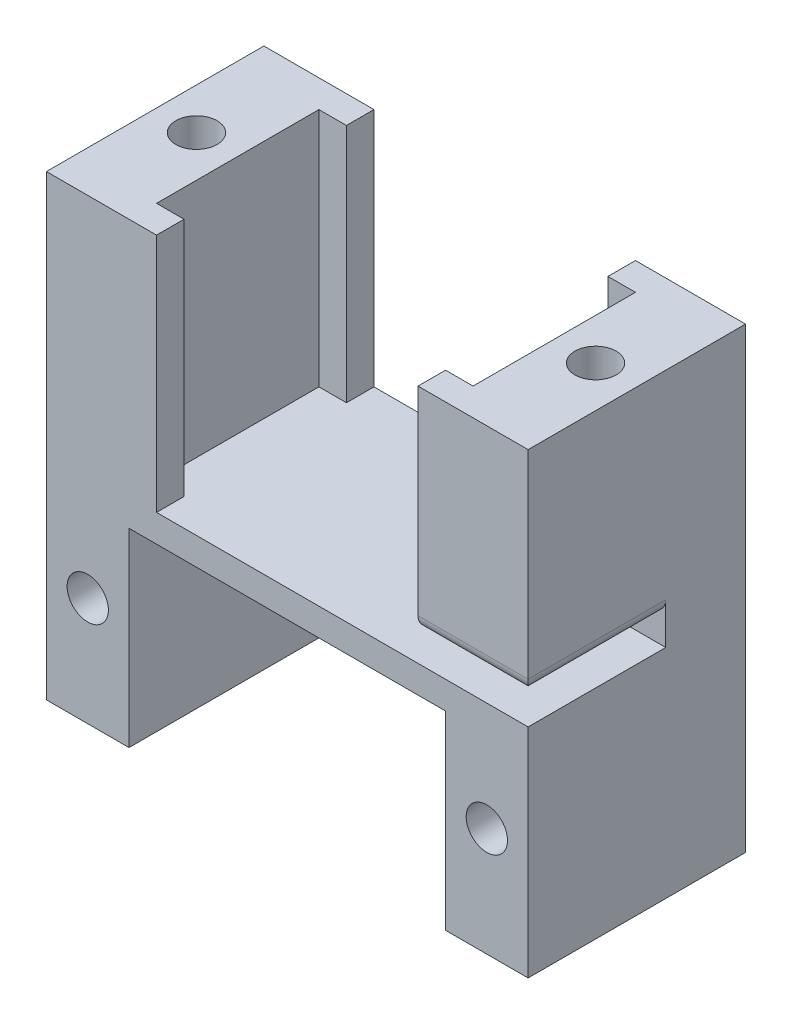
from build123d import *

# Parameters (mm, degrees)
SKETCH1_R           = 1.5
BOSS_EXTRUDE1_DEPTH = 19.45
BOSS_EXTRUDE2_START = -5
SKETCH2_R           = 1.5
BOSS_EXTRUDE2_DEPTH = 5
SKETCH5_W           = 35
SKETCH5_H           = 15.8
BOSS_EXTRUDE3_DEPTH = 2
SKETCH6_R           = 1.5
BOSS_EXTRUDE4_DEPTH = 15.8
SKETCH7_W           = 19
SKETCH7_H           = 2
BOSS_EXTRUDE5_DEPTH = 15.8
SKETCH8_W           = 8
SKETCH8_H           = 2
CUT_EXTRUDE1_DEPTH  = 10
FILLET1_R           = 1
SKETCH9_W           = 23
SKETCH9_H           = 2
CUT_EXTRUDE2_DEPTH  = 44
FILLET2_R           = 1


with BuildPart() as part:
    # Sketch1 → Boss-Extrude1 (new body)
    with BuildSketch(Plane(origin=(0, 0, 0), x_dir=(1, 0, 0), z_dir=(0, 1, 0))):
        Polygon((-5, 7.9), (3, 7.9), (3, 5.9), (3, -5.9), (3, -7.9), (-5, -7.9), (-5, -5.9), (-3, -5.9), (-3, 5.9), (-5, 5.9), align=None)
        with Locations(Location((0, 0, 0), (0, 0, 270))):
            Circle(SKETCH1_R, mode=Mode.SUBTRACT)
    extrude(amount=-BOSS_EXTRUDE1_DEPTH)

    # Sketch2 → Boss-Extrude2 (add)
    with BuildSketch(Plane.XZ.offset(19.45).offset(BOSS_EXTRUDE2_START)):
        with Locations(Location((0, 0, 0), (0, 0, 90))):
            Circle(SKETCH2_R)
    extrude(amount=BOSS_EXTRUDE2_DEPTH)


with BuildPart() as body_2:
    # Mirror2: mirrored copy
    add(part.part.mirror(Plane.ZY.offset(14.5)))


with BuildPart() as part_1:
    add(part.part)

    add(body_2.part)  # Boss-Extrude3 merges body 2
    # Sketch5 → Boss-Extrude3 (add)
    with BuildSketch(Plane.XZ.offset(19.45)):
        with Locations((-14.5, 0)):
            Rectangle(SKETCH5_W, SKETCH5_H)
    extrude(amount=-BOSS_EXTRUDE3_DEPTH)

    # Sketch6 → Boss-Extrude4 (add)
    # profile 1 of 2: a face of its own
    with BuildSketch(Plane.XY.offset(7.9)):
        Polygon((-26, -31.25), (-26, -19.45), (-32, -19.45), (-32, -31.25), (-32, -33.25), (-24, -33.25), (-24, -31.25), align=None)
        with Locations((-29, -25.35)):
            Circle(SKETCH6_R, mode=Mode.SUBTRACT)
    # profile 2 of 2: a face of its own
    with BuildSketch(Plane.XY.offset(7.9)):
        Polygon((-3, -19.45), (-3, -31.25), (-5, -31.25), (-5, -33.25), (3, -33.25), (3, -31.25), (3, -19.45), align=None)
        with Locations((0, -25.35)):
            Circle(SKETCH6_R, mode=Mode.SUBTRACT)
    extrude(amount=-BOSS_EXTRUDE4_DEPTH)

    # Sketch7 → Boss-Extrude5 (add)
    with BuildSketch(Plane.XY.offset(7.9)):
        with Locations((-14.5, -32.25)):
            Rectangle(SKETCH7_W, SKETCH7_H)
    extrude(amount=-BOSS_EXTRUDE5_DEPTH)

    # Sketch8 → Cut-Extrude1 (cut)
    with BuildSketch(Plane.XY.offset(7.9)):
        with Locations((-1, -16.45)):
            Rectangle(SKETCH8_W, SKETCH8_H)
    extrude(amount=-CUT_EXTRUDE1_DEPTH, mode=Mode.SUBTRACT)

    # Fillet1
    fillet1_edges = [part_1.edges().sort_by_distance(p)[0] for p in [
        (3, -15.45, 2.9),
        (-1, -15.45, 7.9),
    ]]
    fillet(fillet1_edges, radius=FILLET1_R)

    # Sketch9 → Cut-Extrude2 (cut)
    with BuildSketch(Plane.XY.offset(7.9)):
        with Locations((-14.5, -32.25)):
            Rectangle(SKETCH9_W, SKETCH9_H)
    extrude(amount=-CUT_EXTRUDE2_DEPTH, mode=Mode.SUBTRACT)

    # Fillet2
    fillet2_edges = [part_1.edges().sort_by_distance(p)[0] for p in [
        (-26, -26.35, -7.9),
        (-3, -26.35, -7.9),
    ]]
    fillet(fillet2_edges, radius=FILLET2_R)


solid = part_1.part
